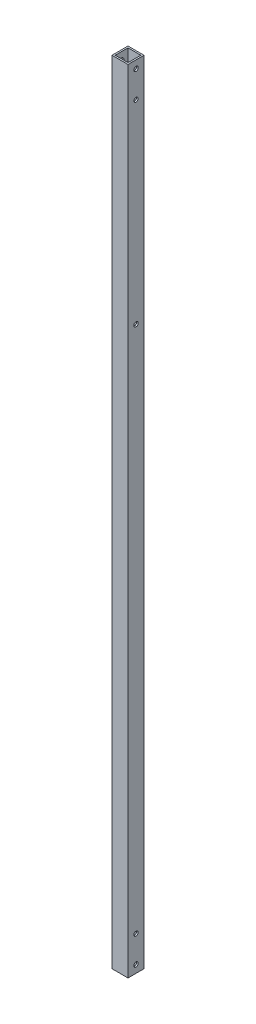
from build123d import *

# Parameters (mm, degrees)
SKETCH_1_W          = 15
SKETCH_1_H          = 15
SKETCH_1_W_2        = 12
SKETCH_1_H_2        = 12
EXTRUDE_1_DEPTH     = 741
SKETCH_2_R          = 2.1
SKETCH_2_R_2        = 2
CUT_EXTRUDE_1_DEPTH = 742.189753032


with BuildPart() as part:
    # ｽｹｯﾁ1 → 押し出し-薄板1 (new body)
    with BuildSketch(Plane(origin=(0, 0, 0), x_dir=(1, 0, 0), z_dir=(0, 1, 0))):
        Rectangle(SKETCH_1_W, SKETCH_1_H)
        Rectangle(SKETCH_1_W_2, SKETCH_1_H_2, mode=Mode.SUBTRACT)
    extrude(amount=EXTRUDE_1_DEPTH)

    # ｽｹｯﾁ2 → ｶｯﾄ - 押し出し1 (cut, through all)
    with BuildSketch(Plane(origin=(7.5, 0, 0), x_dir=(0, 0, -1), z_dir=(1, 0, 0))):
        with Locations((0, 7.29)):
            Circle(SKETCH_2_R)
        with Locations((0, 32.29)):
            Circle(SKETCH_2_R_2)
        with Locations((0, 708.71)):
            Circle(SKETCH_2_R_2)
        with Locations((0, 733.71)):
            Circle(SKETCH_2_R)
        with Locations((0, 526.49)):
            Circle(SKETCH_2_R)
    extrude(amount=-CUT_EXTRUDE_1_DEPTH, mode=Mode.SUBTRACT)


solid = part.part
